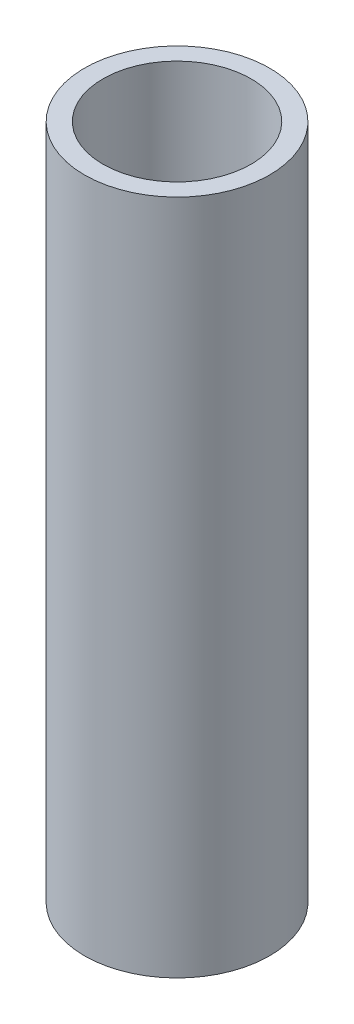
from build123d import *

# Parameters (mm, degrees)
SKETCH1_R           = 3.75
SKETCH1_R_2         = 3
BOSS_EXTRUDE1_DEPTH = 27.395089004


with BuildPart() as part:
    # Sketch1 → Boss-Extrude1 (new body)
    with BuildSketch(Plane(origin=(0, 0, 0), x_dir=(1, 0, 0), z_dir=(0, 1, 0))):
        with Locations(Location((0, 0, 0), (0, 0, 270))):
            Circle(SKETCH1_R)
        with Locations(Location((0, 0, 0), (0, 0, 270))):
            Circle(SKETCH1_R_2, mode=Mode.SUBTRACT)
    extrude(amount=BOSS_EXTRUDE1_DEPTH)


solid = part.part
